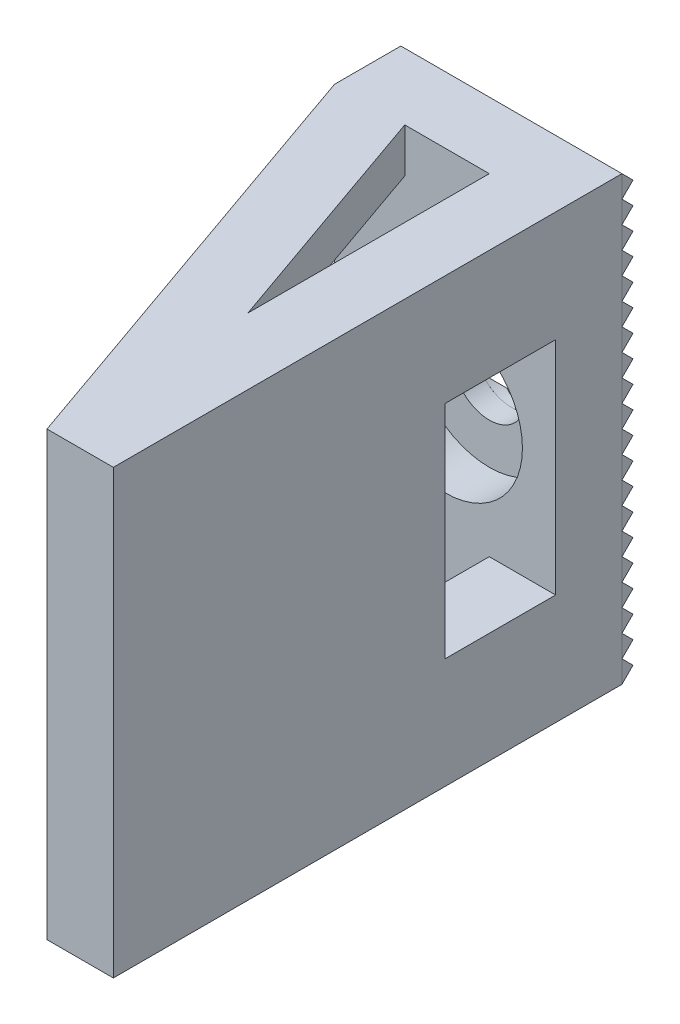
from build123d import *

# Parameters (mm, degrees)
SKETCH1_W              = 10
SKETCH1_H              = 20
BOSS_EXTRUDE1_DEPTH    = 3
SKETCH2_W              = 3
SKETCH2_H              = 20
BOSS_EXTRUDE2_DEPTH    = 20
BOSS_EXTRUDE3_DEPTH    = 2
BOSS_EXTRUDE4_START    = -20
BOSS_EXTRUDE4_DEPTH    = 2
SKETCH4_W              = 5
SKETCH4_H              = 10
CUT_EXTRUDE1_DEPTH     = 12
BOSS_EXTRUDE9_DEPTH    = 10
BOSS_EXTRUDE9_2_DEPTH  = 10
BOSS_EXTRUDE9_3_DEPTH  = 10
BOSS_EXTRUDE9_4_DEPTH  = 10
BOSS_EXTRUDE9_5_DEPTH  = 10
BOSS_EXTRUDE9_6_DEPTH  = 10
BOSS_EXTRUDE9_7_DEPTH  = 10
BOSS_EXTRUDE9_8_DEPTH  = 10
BOSS_EXTRUDE9_9_DEPTH  = 10
BOSS_EXTRUDE9_10_DEPTH = 10
BOSS_EXTRUDE9_11_DEPTH = 10
BOSS_EXTRUDE9_12_DEPTH = 10
BOSS_EXTRUDE9_13_DEPTH = 10
BOSS_EXTRUDE9_14_DEPTH = 10
BOSS_EXTRUDE9_15_DEPTH = 10
BOSS_EXTRUDE9_16_DEPTH = 10
BOSS_EXTRUDE9_17_DEPTH = 10
BOSS_EXTRUDE9_18_DEPTH = 10
BOSS_EXTRUDE9_19_DEPTH = 10
BOSS_EXTRUDE9_20_DEPTH = 10
SKETCH6_R              = 1.65
CUT_EXTRUDE2_DEPTH     = 12
SKETCH7_R              = 3.5
CUT_EXTRUDE3_DEPTH     = 2


with BuildPart() as part:
    # Sketch1 → Boss-Extrude1 (new body)
    with BuildSketch(Plane.XY):
        Rectangle(SKETCH1_W, SKETCH1_H)
    extrude(amount=BOSS_EXTRUDE1_DEPTH)

    # Sketch2 → Boss-Extrude2 (add)
    with BuildSketch(Plane.XY.offset(3)):
        with Locations((3.5, 0)):
            Rectangle(SKETCH2_W, SKETCH2_H)
    extrude(amount=BOSS_EXTRUDE2_DEPTH)

    # Sketch3 → Boss-Extrude3 (add)
    with BuildSketch(Plane.XZ.offset(10)):
        Polygon((2, 23), (-5, 3), (-1.821556985, 3), (2, 13.918734243), align=None)
    extrude(amount=-BOSS_EXTRUDE3_DEPTH)

    # Sketch3<2> → Boss-Extrude4 (add)
    with BuildSketch(Plane.XZ.offset(10).offset(BOSS_EXTRUDE4_START)):
        Polygon((2, 23), (-5, 3), (-1.821556985, 3), (2, 13.918734243), align=None)
    extrude(amount=BOSS_EXTRUDE4_DEPTH)

    # Sketch4 → Cut-Extrude1 (cut)
    with BuildSketch(Plane.ZY.offset(-2)):
        with Locations((5.5, 0)):
            Rectangle(SKETCH4_W, SKETCH4_H)
    extrude(amount=-CUT_EXTRUDE1_DEPTH, mode=Mode.SUBTRACT)


with BuildPart() as body_2:
    # Sketch5 → Boss-Extrude9 (new body)
    with BuildSketch(Plane(origin=(5, 0, 0), x_dir=(0, 0, -1), z_dir=(1, 0, 0))):
        Polygon((0.5, -9.5), (0, -9), (0, -10), align=None)
    extrude(amount=-BOSS_EXTRUDE9_DEPTH)


with BuildPart() as body_3:
    # Sketch5 → Boss-Extrude9 2 (new body)
    with BuildSketch(Plane(origin=(5, 0, 0), x_dir=(0, 0, -1), z_dir=(1, 0, 0))):
        Polygon((0.5, -0.5), (0, 0), (0, -1), align=None)
    extrude(amount=-BOSS_EXTRUDE9_2_DEPTH)


with BuildPart() as body_4:
    # Sketch5 → Boss-Extrude9 3 (new body)
    with BuildSketch(Plane(origin=(5, 0, 0), x_dir=(0, 0, -1), z_dir=(1, 0, 0))):
        Polygon((0.5, 0.5), (0, 1), (0, 0), align=None)
    extrude(amount=-BOSS_EXTRUDE9_3_DEPTH)


with BuildPart() as body_5:
    # Sketch5 → Boss-Extrude9 4 (new body)
    with BuildSketch(Plane(origin=(5, 0, 0), x_dir=(0, 0, -1), z_dir=(1, 0, 0))):
        Polygon((0.5, 1.5), (0, 2), (0, 1), align=None)
    extrude(amount=-BOSS_EXTRUDE9_4_DEPTH)


with BuildPart() as body_6:
    # Sketch5 → Boss-Extrude9 5 (new body)
    with BuildSketch(Plane(origin=(5, 0, 0), x_dir=(0, 0, -1), z_dir=(1, 0, 0))):
        Polygon((0, -8), (0, -9), (0.5, -8.5), align=None)
    extrude(amount=-BOSS_EXTRUDE9_5_DEPTH)


with BuildPart() as body_7:
    # Sketch5 → Boss-Extrude9 6 (new body)
    with BuildSketch(Plane(origin=(5, 0, 0), x_dir=(0, 0, -1), z_dir=(1, 0, 0))):
        Polygon((0, -7), (0, -8), (0.5, -7.5), align=None)
    extrude(amount=-BOSS_EXTRUDE9_6_DEPTH)


with BuildPart() as body_8:
    # Sketch5 → Boss-Extrude9 7 (new body)
    with BuildSketch(Plane(origin=(5, 0, 0), x_dir=(0, 0, -1), z_dir=(1, 0, 0))):
        Polygon((0, -6), (0, -7), (0.5, -6.5), align=None)
    extrude(amount=-BOSS_EXTRUDE9_7_DEPTH)


with BuildPart() as body_9:
    # Sketch5 → Boss-Extrude9 8 (new body)
    with BuildSketch(Plane(origin=(5, 0, 0), x_dir=(0, 0, -1), z_dir=(1, 0, 0))):
        Polygon((0, -5), (0, -6), (0.5, -5.5), align=None)
    extrude(amount=-BOSS_EXTRUDE9_8_DEPTH)


with BuildPart() as body_10:
    # Sketch5 → Boss-Extrude9 9 (new body)
    with BuildSketch(Plane(origin=(5, 0, 0), x_dir=(0, 0, -1), z_dir=(1, 0, 0))):
        Polygon((0, -4), (0, -5), (0.5, -4.5), align=None)
    extrude(amount=-BOSS_EXTRUDE9_9_DEPTH)


with BuildPart() as body_11:
    # Sketch5 → Boss-Extrude9 10 (new body)
    with BuildSketch(Plane(origin=(5, 0, 0), x_dir=(0, 0, -1), z_dir=(1, 0, 0))):
        Polygon((0, -3), (0, -4), (0.5, -3.5), align=None)
    extrude(amount=-BOSS_EXTRUDE9_10_DEPTH)


with BuildPart() as body_12:
    # Sketch5 → Boss-Extrude9 11 (new body)
    with BuildSketch(Plane(origin=(5, 0, 0), x_dir=(0, 0, -1), z_dir=(1, 0, 0))):
        Polygon((0, -2), (0, -3), (0.5, -2.5), align=None)
    extrude(amount=-BOSS_EXTRUDE9_11_DEPTH)


with BuildPart() as body_13:
    # Sketch5 → Boss-Extrude9 12 (new body)
    with BuildSketch(Plane(origin=(5, 0, 0), x_dir=(0, 0, -1), z_dir=(1, 0, 0))):
        Polygon((0, -1), (0, -2), (0.5, -1.5), align=None)
    extrude(amount=-BOSS_EXTRUDE9_12_DEPTH)


with BuildPart() as body_14:
    # Sketch5 → Boss-Extrude9 13 (new body)
    with BuildSketch(Plane(origin=(5, 0, 0), x_dir=(0, 0, -1), z_dir=(1, 0, 0))):
        Polygon((0, 3), (0, 2), (0.5, 2.5), align=None)
    extrude(amount=-BOSS_EXTRUDE9_13_DEPTH)


with BuildPart() as body_15:
    # Sketch5 → Boss-Extrude9 14 (new body)
    with BuildSketch(Plane(origin=(5, 0, 0), x_dir=(0, 0, -1), z_dir=(1, 0, 0))):
        Polygon((0, 4), (0, 3), (0.5, 3.5), align=None)
    extrude(amount=-BOSS_EXTRUDE9_14_DEPTH)


with BuildPart() as body_16:
    # Sketch5 → Boss-Extrude9 15 (new body)
    with BuildSketch(Plane(origin=(5, 0, 0), x_dir=(0, 0, -1), z_dir=(1, 0, 0))):
        Polygon((0, 5), (0, 4), (0.5, 4.5), align=None)
    extrude(amount=-BOSS_EXTRUDE9_15_DEPTH)


with BuildPart() as body_17:
    # Sketch5 → Boss-Extrude9 16 (new body)
    with BuildSketch(Plane(origin=(5, 0, 0), x_dir=(0, 0, -1), z_dir=(1, 0, 0))):
        Polygon((0, 6), (0, 5), (0.5, 5.5), align=None)
    extrude(amount=-BOSS_EXTRUDE9_16_DEPTH)


with BuildPart() as body_18:
    # Sketch5 → Boss-Extrude9 17 (new body)
    with BuildSketch(Plane(origin=(5, 0, 0), x_dir=(0, 0, -1), z_dir=(1, 0, 0))):
        Polygon((0, 7), (0, 6), (0.5, 6.5), align=None)
    extrude(amount=-BOSS_EXTRUDE9_17_DEPTH)


with BuildPart() as body_19:
    # Sketch5 → Boss-Extrude9 18 (new body)
    with BuildSketch(Plane(origin=(5, 0, 0), x_dir=(0, 0, -1), z_dir=(1, 0, 0))):
        Polygon((0, 8), (0, 7), (0.5, 7.5), align=None)
    extrude(amount=-BOSS_EXTRUDE9_18_DEPTH)


with BuildPart() as body_20:
    # Sketch5 → Boss-Extrude9 19 (new body)
    with BuildSketch(Plane(origin=(5, 0, 0), x_dir=(0, 0, -1), z_dir=(1, 0, 0))):
        Polygon((0, 9), (0, 8), (0.5, 8.5), align=None)
    extrude(amount=-BOSS_EXTRUDE9_19_DEPTH)


with BuildPart() as body_21:
    # Sketch5 → Boss-Extrude9 20 (new body)
    with BuildSketch(Plane(origin=(5, 0, 0), x_dir=(0, 0, -1), z_dir=(1, 0, 0))):
        Polygon((0, 10), (0, 9), (0.5, 9.5), align=None)
    extrude(amount=-BOSS_EXTRUDE9_20_DEPTH)


with BuildPart() as cut_extrude2_tool:
    # Sketch6 → Cut-Extrude2 (new body)
    with BuildSketch(Plane.XY.offset(3)):
        Circle(SKETCH6_R)
    extrude(amount=-CUT_EXTRUDE2_DEPTH)


with BuildPart() as part_1:
    add(part.part)

    # Cut-Extrude2: cut by cut_extrude2_tool
    add(cut_extrude2_tool.part, mode=Mode.SUBTRACT)

    # Sketch7 → Cut-Extrude3 (cut)
    with BuildSketch(Plane.XY.offset(3)):
        Circle(SKETCH7_R)
    extrude(amount=-CUT_EXTRUDE3_DEPTH, mode=Mode.SUBTRACT)


with BuildPart() as body_3_1:
    add(body_3.part)

    # Cut-Extrude2: cut by cut_extrude2_tool
    add(cut_extrude2_tool.part, mode=Mode.SUBTRACT)


with BuildPart() as body_4_1:
    add(body_4.part)

    # Cut-Extrude2: cut by cut_extrude2_tool
    add(cut_extrude2_tool.part, mode=Mode.SUBTRACT)


with BuildPart() as body_5_1:
    add(body_5.part)

    # Cut-Extrude2: cut by cut_extrude2_tool
    add(cut_extrude2_tool.part, mode=Mode.SUBTRACT)


with BuildPart() as body_13_1:
    add(body_13.part)

    # Cut-Extrude2: cut by cut_extrude2_tool
    add(cut_extrude2_tool.part, mode=Mode.SUBTRACT)


solid = Compound([body_2.part, body_6.part, body_7.part, body_8.part, body_9.part, body_10.part, body_11.part, body_12.part, body_14.part, body_15.part, body_16.part, body_17.part, body_18.part, body_19.part, body_20.part, body_21.part, part_1.part, body_3_1.part, body_4_1.part, body_5_1.part, body_13_1.part])
